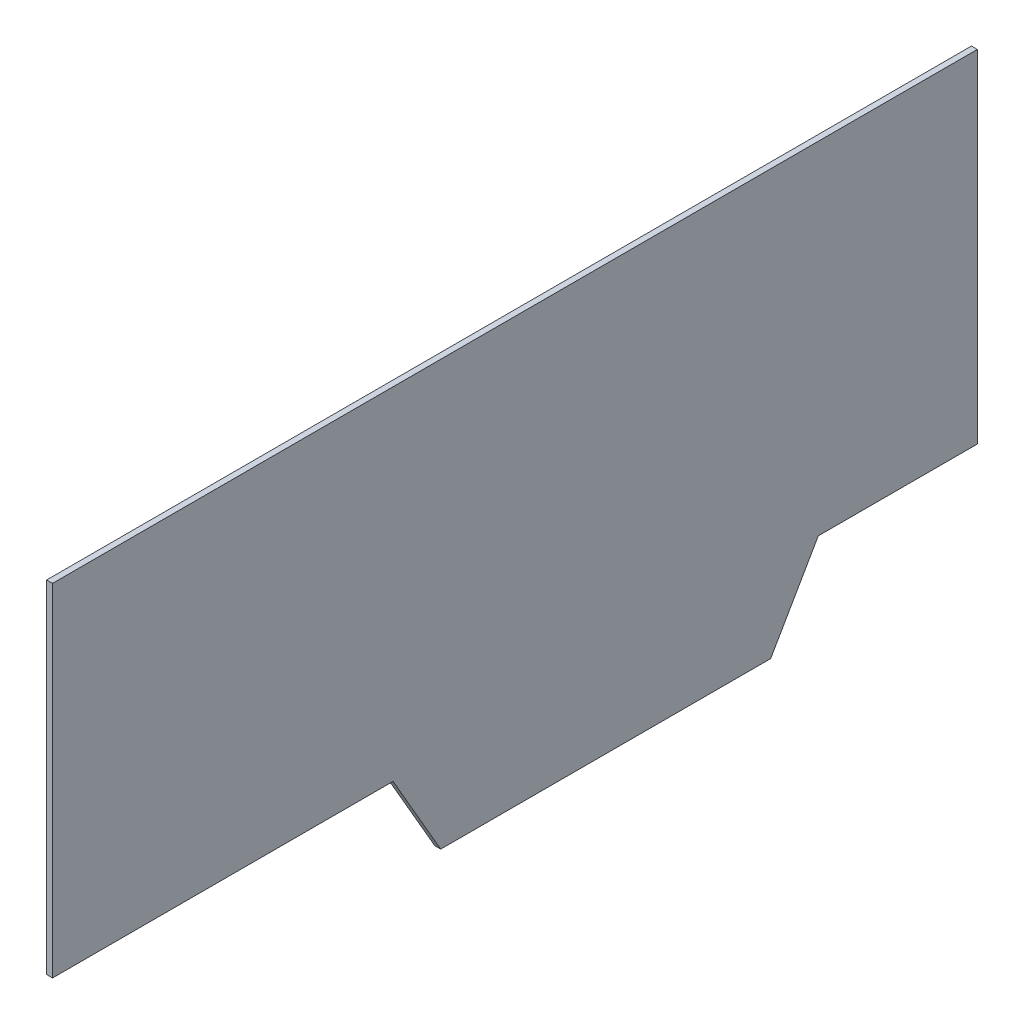
from build123d import *

# Parameters (mm, degrees)
SKETCH1_W           = 498.348
SKETCH1_H           = 177.8
BOSS_EXTRUDE1_DEPTH = 1.5875
BOSS_EXTRUDE2_DEPTH = 3.175


with BuildPart() as part:
    # Sketch1 → Boss-Extrude1 (new, symmetric)
    with BuildSketch(Plane(origin=(0, 0, 0), x_dir=(0, 0, -1), z_dir=(1, 0, 0))):
        Rectangle(SKETCH1_W, SKETCH1_H)
    extrude(amount=BOSS_EXTRUDE1_DEPTH, both=True)

    # Sketch2 → Boss-Extrude2 (add)
    with BuildSketch(Plane(origin=(1.5875, 0, 0), x_dir=(0, 0, -1), z_dir=(1, 0, 0))):
        Polygon((249.174, -95.25), (249.174, -88.9), (-249.174, -88.9), (-249.174, -95.25), (-65.677438931, -95.25), (-40.014219465, -139.7), (137.785780535, -139.7), (163.449, -95.25), align=None)
    extrude(amount=-BOSS_EXTRUDE2_DEPTH)


solid = part.part
